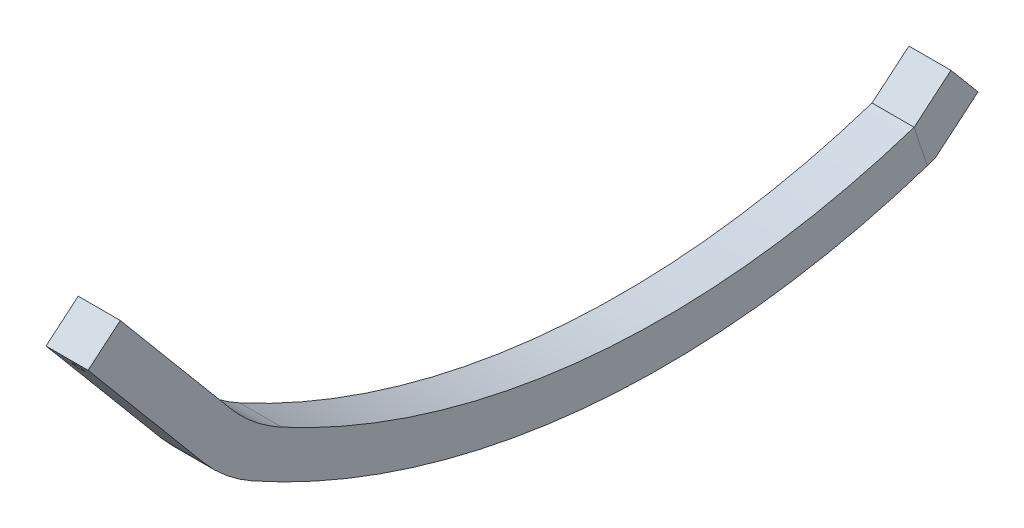
from build123d import *

# Parameters (mm, degrees)
AUFSATZ_LINEAR_AUSTRAGEN1_DEPTH = 12
AUFSATZ_LINEAR_AUSTRAGEN3_DEPTH = 12
AUFSATZ_LINEAR_AUSTRAGEN4_DEPTH = 12
SCHNITT_LINEAR_AUSTRAGEN1_DEPTH = 254.175024926
VERRUNDUNG1_R                   = 50
SKIZZE9_W                       = 12
SKIZZE9_H                       = 12
AUFSATZ_LINEAR_AUSTRAGEN6_DEPTH = 12
SKIZZE11_R                      = 1.55
SCHNITT_LINEAR_AUSTRAGEN4_DEPTH = 223.406401048


with BuildPart() as part:
    # Skizze1 → Aufsatz-Linear austragen1 (new body)
    with BuildSketch(Plane(origin=(0, 0, 0), x_dir=(0, 0, -1), z_dir=(1, 0, 0))):
        with BuildLine():
            Line((-240, 65), (-230.735708163, 72.773663864))
            ThreePointArc((-230.735708163, 72.773663864), (-123.944567763, 17.242039243), (-3.735818811, 23.403668612))
            Line((-3.735818811, 23.403668612), (0, 12))
            ThreePointArc((0, 12), (-127.247502729, 5.681119716), (-240, 65))
        make_face()
    extrude(amount=AUFSATZ_LINEAR_AUSTRAGEN1_DEPTH)

    # Skizze5 → Aufsatz-Linear austragen4 (add)
    with BuildSketch(Plane(origin=(12, 0, 0), x_dir=(0, 0, -1), z_dir=(1, 0, 0))):
        Polygon((-231.662517154, 71.995978781), (-222.469983836, 79.709430098), (-210.899806862, 65.920630121), (-192.948331238, 44.526894555), (-220.092340179, 58.207178805), align=None)
    extrude(amount=-AUFSATZ_LINEAR_AUSTRAGEN4_DEPTH)

    # Skizze6 → Schnitt-Linear austragen1 (cut, through all)
    with BuildSketch(Plane(origin=(12, 0, 0), x_dir=(0, 0, -1), z_dir=(1, 0, 0))):
        Polygon((-231.662517154, 71.995978781), (-199.510648028, 33.678873242), (-204.367668784, 29.603348917), (-240, 65), align=None)
    extrude(amount=-SCHNITT_LINEAR_AUSTRAGEN1_DEPTH, mode=Mode.SUBTRACT)

    # Verrundung1
    verrundung1_edges = [part.edges().sort_by_distance(p)[0] for p in [
        (6, 44.526894555, 192.948331238),
        (6, 35.285406895, 200.858689823),
    ]]
    fillet(verrundung1_edges, radius=VERRUNDUNG1_R)

    # Skizze9 → Aufsatz-Linear austragen6 (add)
    with BuildSketch(Plane(origin=(0, 156.320496136, 131.168470653), x_dir=(1, 0, 0), z_dir=(0, 0.7660444431189836, 0.6427876096865328))):
        with Locations((6, -125.185660837)):
            Rectangle(SKIZZE9_W, SKIZZE9_H)
    extrude(amount=AUFSATZ_LINEAR_AUSTRAGEN6_DEPTH)

    # Skizze11 → Schnitt-Linear austragen4 (cut, through all)
    with BuildSketch(Plane(origin=(0, -76.611066038, 91.301513183), x_dir=(-1, 0, 0), z_dir=(0, 0.6427876096865329, -0.7660444431189836))):
        with Locations(Location((-6, 211.061915128, 0), (0, 0, 90))):
            Circle(SKIZZE11_R)
    extrude(amount=-SCHNITT_LINEAR_AUSTRAGEN4_DEPTH, mode=Mode.SUBTRACT)


with BuildPart() as body_2:
    # Skizze4 → Aufsatz-Linear austragen3 (new body)
    with BuildSketch(Plane(origin=(0, 0, 0), x_dir=(0, 0, -1), z_dir=(1, 0, 0))):
        with BuildLine():
            Line((-3.735818811, 23.403668612), (6.769031275, 32.218284445))
            Line((6.769031275, 32.218284445), (14.482482591, 23.025751128))
            Line((14.482482591, 23.025751128), (2.225771501, 12.741149373))
            ThreePointArc((2.225771501, 12.741149373), (1.113785782, 12.367871772), (0, 12))
            Line((0, 12), (-3.735818811, 23.403668612))
        make_face()
    extrude(amount=AUFSATZ_LINEAR_AUSTRAGEN3_DEPTH)


solid = Compound([part.part, body_2.part])
